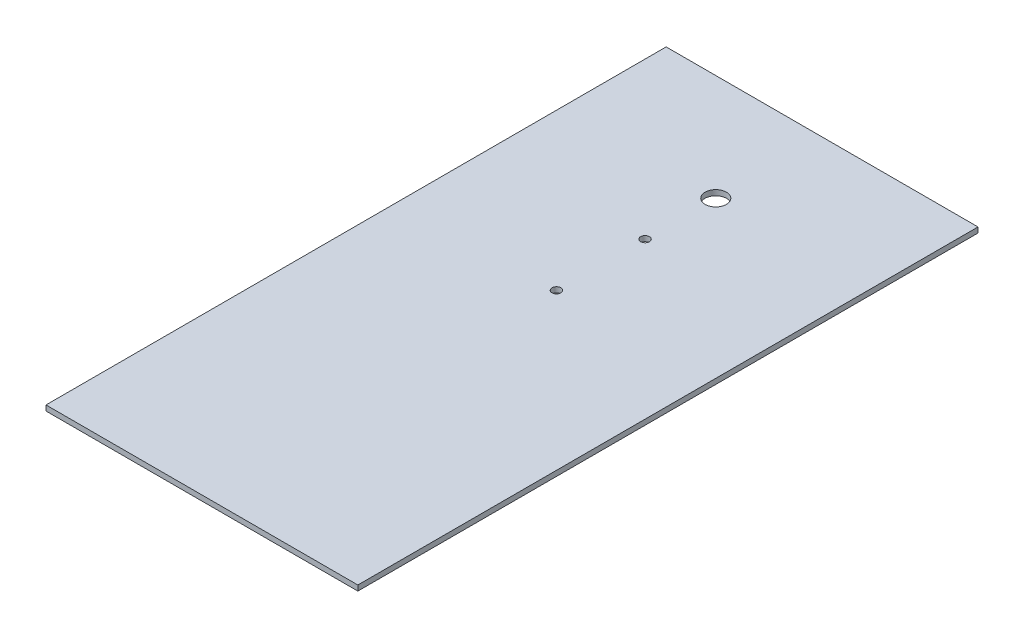
from build123d import *

# Parameters (mm, degrees)
SKETCH1_W              = 176
SKETCH1_H              = 350
BOSS_EXTRUDE1_DEPTH    = 3
F_5_0MM_DOWEL_HOLE1_D  = 5
F_12_0MM_DOWEL_HOLE1_D = 12


with BuildPart() as part:
    # Sketch1 → Boss-Extrude1 (new body)
    with BuildSketch(Plane(origin=(0, 0, 0), x_dir=(1, 0, 0), z_dir=(0, 1, 0))):
        with Locations((88, 175)):
            Rectangle(SKETCH1_W, SKETCH1_H)
    extrude(amount=BOSS_EXTRUDE1_DEPTH)

    # Ø5.0mm Dowel Hole1 (through all)
    with Locations(Plane(origin=(0, 0, 0), x_dir=(-1, 0, 0), z_dir=(0, -1, 0))):
        with Locations((-88.016913139, 250.06), (-88.016913139, 200.06)):
            Hole(F_5_0MM_DOWEL_HOLE1_D / 2)

    # Ø12.0mm Dowel Hole1 (through all)
    with Locations(Plane(origin=(0, 0, 0), x_dir=(-1, 0, 0), z_dir=(0, -1, 0))):
        with Locations((-88, 290)):
            Hole(F_12_0MM_DOWEL_HOLE1_D / 2)


solid = part.part
